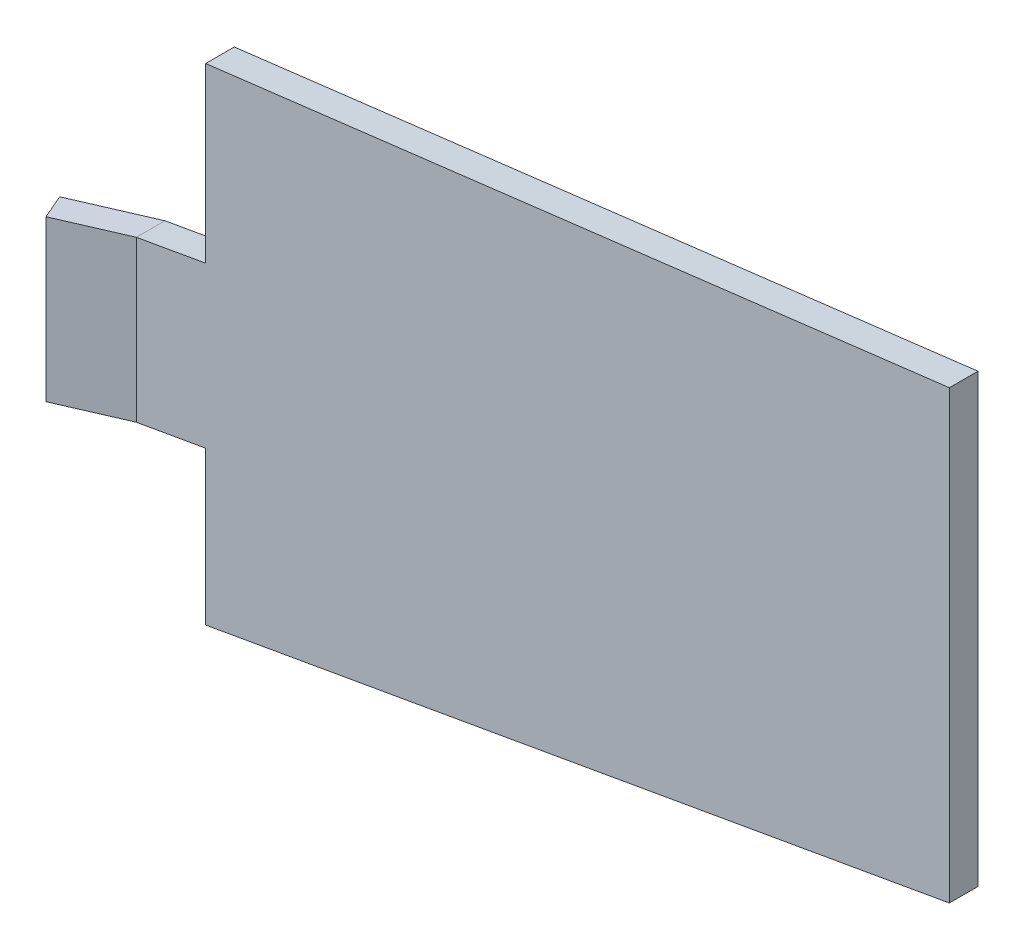
from build123d import *

# Parameters (mm, degrees)
RESSALTO_EXTRUS_O1_DEPTH      = 5
RESSALTO_EXTRUS_O2_DEPTH      = 5
RESSALTO_EXTRUS_O3_DEPTH      = 12
RESSALTO_EXTRUS_O3_DEPTH_BACK = 1.993745
ESBO_O4_W                     = 28
ESBO_O4_H                     = 4.585300372


with BuildPart() as part:
    # Esboço1 → Ressalto-extrusão1 (new body)
    with BuildSketch(Plane.XY):
        Polygon((0, 85), (0, 0), (130, 22.922507492), (130, 100.922507492), align=None)
    extrude(amount=RESSALTO_EXTRUS_O1_DEPTH)

    # Esboço3 → Ressalto-extrusão2 (add)
    with BuildSketch(Plane.XY.offset(5)):
        Polygon((-12.113135362, 52.639941774), (0, 54.775814359), (0, 26.775814359), (-12.113135362, 24.639941774), align=None)
    extrude(amount=-RESSALTO_EXTRUS_O2_DEPTH)

    # Esboço4 → Ressalto-extrusão3 (add, two sides: drawn at the far end of the back side and taken through both)
    with BuildSketch(Plane(origin=(-12.015521161, 0, 5.224497292), x_dir=(0, -1, 0), z_dir=(-0.9170600743851252, 0, 0.39874906892524387)).offset(-RESSALTO_EXTRUS_O3_DEPTH_BACK)):
        with Locations((-38.639941774, -2.537451261)):
            Rectangle(ESBO_O4_W, ESBO_O4_H)
    extrude(amount=RESSALTO_EXTRUS_O3_DEPTH + RESSALTO_EXTRUS_O3_DEPTH_BACK)


solid = part.part
